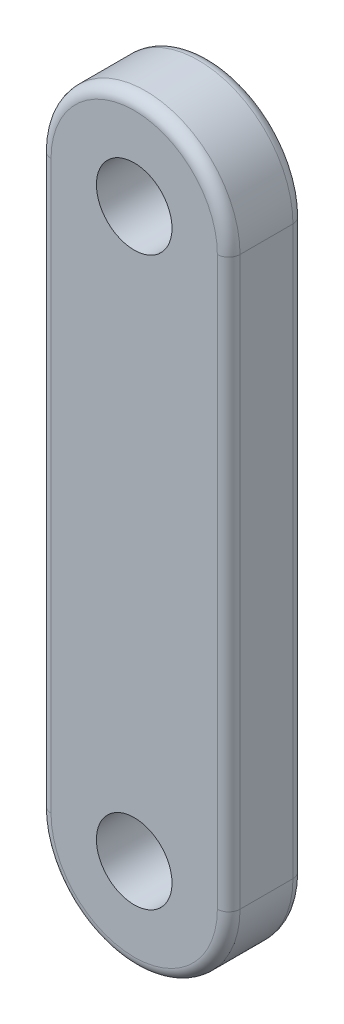
from build123d import *

# Parameters (mm, degrees)
SKETCH_1_R      = 1
EXTRUDE_2_DEPTH = 2
FILLET_1_R      = 0.3


with BuildPart() as part:
    # 草图1 → 凸台-拉伸2 (new body)
    with BuildSketch(Plane.XY):
        with BuildLine():
            Line((-22.5, 1.029411765), (-22.5, 16.029411765))
            ThreePointArc((-22.5, 16.029411765), (-20, 18.529411765), (-17.5, 16.029411765))
            Line((-17.5, 16.029411765), (-17.5, 1.029411765))
            ThreePointArc((-17.5, 1.029411765), (-20, -1.470588235), (-22.5, 1.029411765))
        make_face()
        with Locations((-20, 16.029411765)):
            Circle(SKETCH_1_R, mode=Mode.SUBTRACT)
        with Locations((-20, 1.029411765)):
            Circle(SKETCH_1_R, mode=Mode.SUBTRACT)
    extrude(amount=EXTRUDE_2_DEPTH)

    # 圆角1
    fillet_1_edges = [part.edges().sort_by_distance(p)[0] for p in [
        (-20, 18.529411765, 2),
        (-22.5, 8.529411765, 2),
        (-20, -1.470588235, 2),
        (-22.5, 8.529411765, 0),
        (-20, 18.529411765, 0),
        (-17.5, 8.529411765, 0),
        (-20, -1.470588235, 0),
        (-17.5, 8.529411765, 2),
    ]]
    fillet(fillet_1_edges, radius=FILLET_1_R)


solid = part.part
